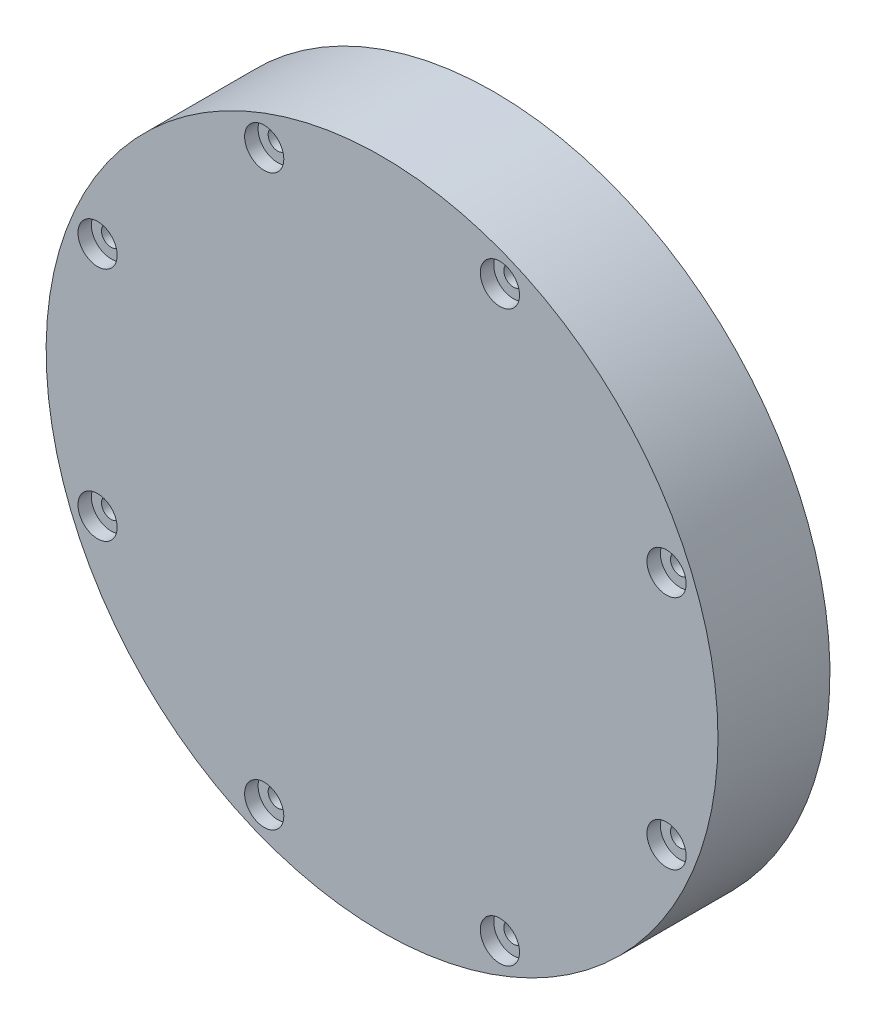
from build123d import *

# Parameters (mm, degrees)
SALIENTE_EXTRUIR1_DEPTH                              = 15
CROQUIS2_R                                           = 60
SALIENTE_EXTRUIR2_DEPTH                              = 5
REFRENTADO_PARA_TORNILLO_CON_CABEZA_TRON_D           = 3.4
REFRENTADO_PARA_TORNILLO_CON_CABEZA_TRON_CBORE_D     = 7
REFRENTADO_PARA_TORNILLO_CON_CABEZA_TRON_CBORE_DEPTH = 2.4


with BuildPart() as part:
    # Croquis1 → Saliente-Extruir1 (new body)
    with BuildSketch(Plane.XY):
        with BuildLine():
            Line((-15, -49.849774322), (-15, -54.083269132))
            ThreePointArc((-15, -54.083269132), (-16.245307044, -56.516590449), (-18.947368421, -56.929756981))
            ThreePointArc((-18.947368421, -56.929756981), (0, 60), (18.947368421, -56.929756981))
            ThreePointArc((18.947368421, -56.929756981), (16.245307044, -56.516590449), (15, -54.083269132))
            Line((15, -54.083269132), (15, -49.849774322))
            ThreePointArc((15, -49.849774322), (15.544739955, -48.125912926), (16.981132075, -47.028088983))
            ThreePointArc((16.981132075, -47.028088983), (0, 50), (-16.981132075, -47.028088983))
            ThreePointArc((-16.981132075, -47.028088983), (-15.544739955, -48.125912926), (-15, -49.849774322))
        make_face()
    extrude(amount=SALIENTE_EXTRUIR1_DEPTH)

    # Croquis2 → Saliente-Extruir2 (add)
    with BuildSketch(Plane.XY.offset(15)):
        with Locations(Location((0, 0, 0), (0, 0, 251.591519829))):
            Circle(CROQUIS2_R)
    extrude(amount=SALIENTE_EXTRUIR2_DEPTH)

    # Refrentado para tornillo con cabeza troncocónica de M31 (through all)
    with Locations(Plane.XY.offset(20)):
        with Locations((-21.04758878, 50.813374288), (21.04758878, 50.813374288), (50.813374288, 21.04758878), (50.813374288, -21.04758878), (21.04758878, -50.813374288), (-21.04758878, -50.813374288), (-50.813374288, -21.04758878), (-50.813374288, 21.04758878)):
            CounterBoreHole(REFRENTADO_PARA_TORNILLO_CON_CABEZA_TRON_D / 2, REFRENTADO_PARA_TORNILLO_CON_CABEZA_TRON_CBORE_D / 2, REFRENTADO_PARA_TORNILLO_CON_CABEZA_TRON_CBORE_DEPTH)


solid = part.part
